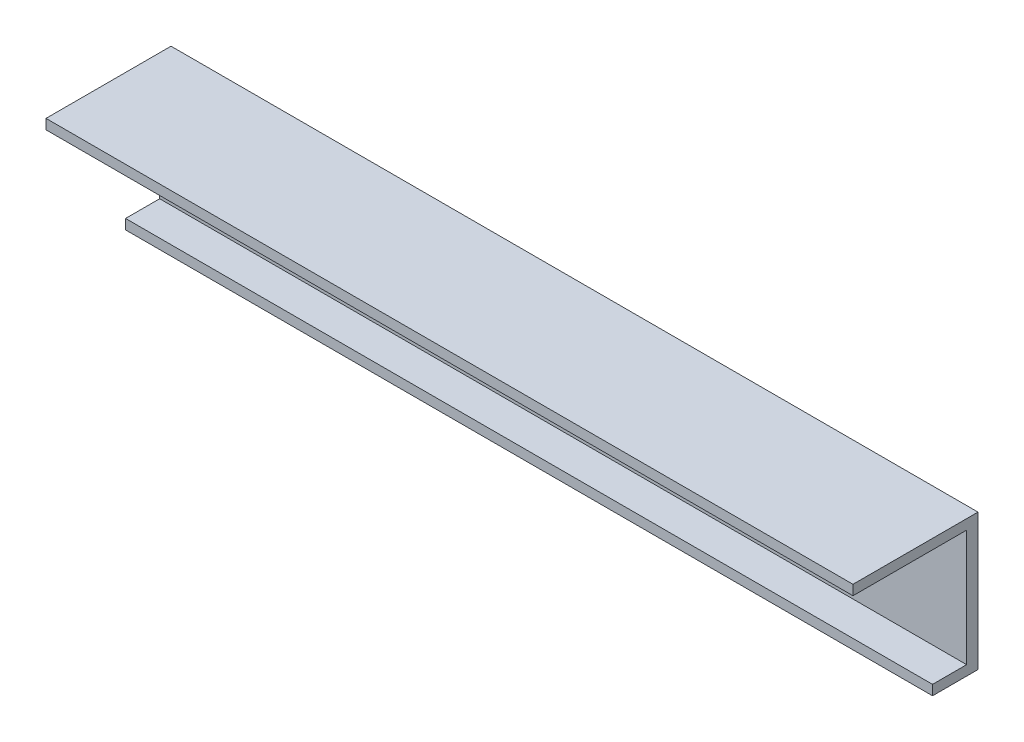
from build123d import *

# Parameters (mm, degrees)
SKETCH_1_W          = 142
SKETCH_1_H          = 24
EXTRUDE_1_DEPTH     = 22
CUT_EXTRUDE_1_DEPTH = 142


with BuildPart() as part:
    # 草图1 → 凸台-拉伸1 (new body)
    with BuildSketch(Plane.XY):
        with Locations((-41.361161705, 12)):
            Rectangle(SKETCH_1_W, SKETCH_1_H)
    extrude(amount=EXTRUDE_1_DEPTH)

    # 草图2 → 切除-拉伸1 (cut)
    with BuildSketch(Plane(origin=(29.638838295, 0, 0), x_dir=(0, 0, -1), z_dir=(1, 0, 0))):
        Polygon((-22, 22.25), (-2, 22.25), (-2, 1.75), (-8, 1.75), (-8, 0), (-22, 0), align=None)
    extrude(amount=-CUT_EXTRUDE_1_DEPTH, mode=Mode.SUBTRACT)


solid = part.part
